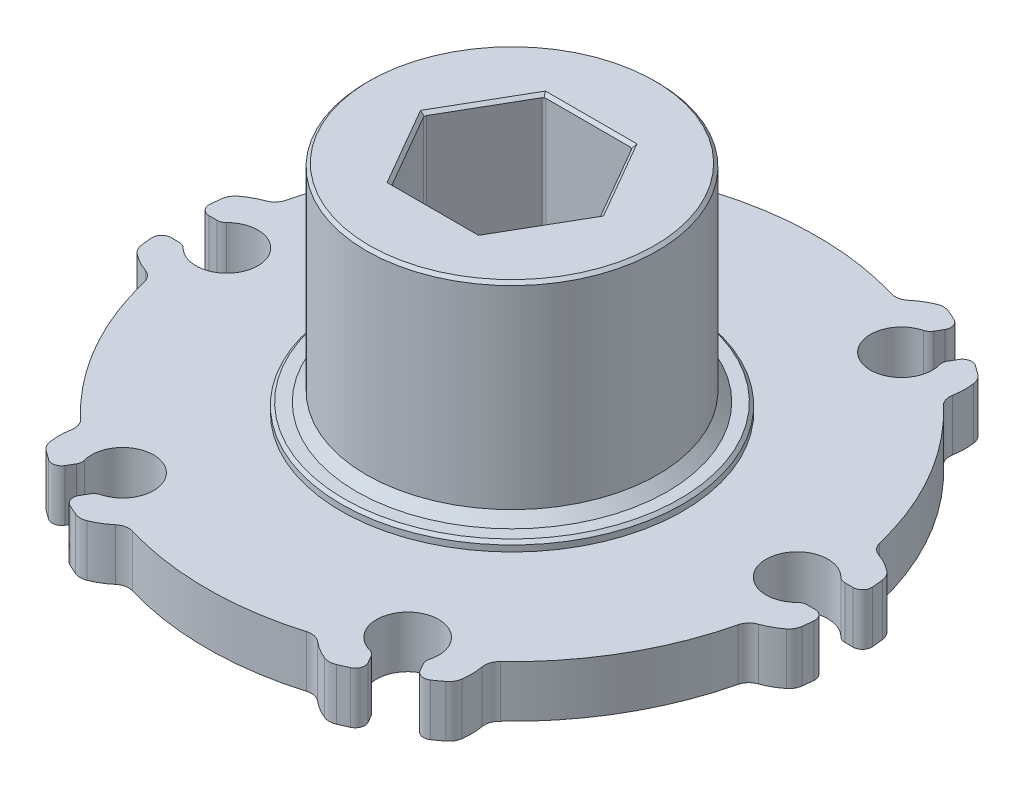
from build123d import *

# Parameters (mm, degrees)
SKETCH1_R                = 27.7876
BOSS_EXTRUDE1_DEPTH      = 8.128
CUT_EXTRUDE1_DEPTH       = 41.129363458
FILLET4_R                = 0.7874
CIRPATTERN1_COUNT        = 6
FILLET4_OF_CIRPATTERN1_R = 0.7874
SKETCH9_R                = 12.1666
BOSS_EXTRUDE2_DEPTH      = 17.272
SKETCH10_R               = 6.4643
CUT_EXTRUDE2_DEPTH       = 47.729610269
SKETCH11_W               = 16.1036
SKETCH11_H               = 3.3147
CUT_EXTRUDE3_DEPTH       = 47.729610269
CHAMFER1_SIZE            = 0.254
FILLET5_R                = 0.127
CHAMFER2_SIZE            = 0.8128
SKETCH12_W               = 23.8252
SKETCH12_H               = 5.08
CHAMFER3_SIZE            = 0.254
SKETCH13_R               = 9.23823544
BOSS_EXTRUDE3_DEPTH      = 25.4
CUT_EXTRUDE4_DEPTH       = 47.729610269
CHAMFER4_SIZE            = 0.254
CUT_EXTRUDE5_DEPTH       = 47.729610269
CIRPATTERN2_COUNT        = 6
FILLET6_R                = 1.27
CHAMFER5_SIZE            = 0.254
FILLET7_R                = 0.254


with BuildPart() as part:
    # Sketch1 → Boss-Extrude1 (new body)
    with BuildSketch(Plane(origin=(0, 0, 0), x_dir=(1, 0, 0), z_dir=(0, 1, 0))):
        with Locations(Location((0, 0, 0), (0, 0, 270))):
            Circle(SKETCH1_R)
    extrude(amount=BOSS_EXTRUDE1_DEPTH)

    # Sketch6 → Cut-Extrude1 (cut, through all)
    with BuildSketch(Plane(origin=(0, 8.128, 0), x_dir=(1, 0, 0), z_dir=(0, 1, 0))):
        with BuildLine():
            Line((25.859959008, 1.5875), (37.457436379, 1.5875))
            Line((37.457436379, 1.5875), (37.457436379, -1.5875))
            Line((37.457436379, -1.5875), (25.859959008, -1.5875))
            ThreePointArc((25.859959008, -1.5875), (21.2217, 0), (25.859959008, 1.5875))
        make_face()
    cut_extrude1 = extrude(amount=-CUT_EXTRUDE1_DEPTH, mode=Mode.SUBTRACT)

    # Fillet4
    fillet4_edges = [part.edges().sort_by_distance(p)[0] for p in [
        (25.859959008, 4.064, -1.5875),
        (27.742216161, 4.064, 1.5875),
        (27.742216161, 4.064, -1.5875),
        (25.859959008, 4.064, 1.5875),
    ]]
    fillet(fillet4_edges, radius=FILLET4_R)

    # CirPattern1: Cut-Extrude1 ×6 about axis
    cirpattern1_axis = Axis((0, 0, 0), (0, 1, 0))
    for i in range(1, CIRPATTERN1_COUNT):
        add(cut_extrude1.rotate(cirpattern1_axis, i * 360 / CIRPATTERN1_COUNT), mode=Mode.SUBTRACT)

    # Fillet4 of CirPattern1
    fillet4_of_cirpattern1_edges = [part.edges().sort_by_distance(p)[0] for p in [
        (11.555164176, 4.064, -23.189131442),
        (15.245923409, 4.064, -23.231713952),
        (12.496292752, 4.064, -24.819213952),
        (14.304794833, 4.064, -21.601631442),
        (-14.304794833, 4.064, -21.601631442),
        (-12.496292752, 4.064, -24.819213952),
        (-15.245923409, 4.064, -23.231713952),
        (-11.555164176, 4.064, -23.189131442),
        (-25.859959008, 4.064, 1.5875),
        (-27.742216161, 4.064, -1.5875),
        (-27.742216161, 4.064, 1.5875),
        (-25.859959008, 4.064, -1.5875),
        (-11.555164176, 4.064, 23.189131442),
        (-15.245923409, 4.064, 23.231713952),
        (-12.496292752, 4.064, 24.819213952),
        (-14.304794833, 4.064, 21.601631442),
        (14.304794833, 4.064, 21.601631442),
        (12.496292752, 4.064, 24.819213952),
        (15.245923409, 4.064, 23.231713952),
        (11.555164176, 4.064, 23.189131442),
    ]]
    fillet(fillet4_of_cirpattern1_edges, radius=FILLET4_OF_CIRPATTERN1_R)

    # Sketch9 → Boss-Extrude2 (add)
    with BuildSketch(Plane(origin=(0, 8.128, 0), x_dir=(-1, 0, 0), z_dir=(0, 1, 0))):
        with Locations(Location((0, 0, 0), (0, 0, 90))):
            Circle(SKETCH9_R)
    extrude(amount=BOSS_EXTRUDE2_DEPTH)

    # Sketch10 → Cut-Extrude2 (cut, through all)
    with BuildSketch(Plane(origin=(0, 25.4, 0), x_dir=(1, 0, 0), z_dir=(0, 1, 0))):
        with Locations(Location((0, 0, 0), (0, 0, 270))):
            Circle(SKETCH10_R)
    extrude(amount=-CUT_EXTRUDE2_DEPTH, mode=Mode.SUBTRACT)

    # Sketch11 → Cut-Extrude3 (cut, through all)
    with BuildSketch(Plane(origin=(0, 25.4, 0), x_dir=(1, 0, 0), z_dir=(0, 1, 0))):
        Rectangle(SKETCH11_W, SKETCH11_H)
    extrude(amount=-CUT_EXTRUDE3_DEPTH, mode=Mode.SUBTRACT)

    # Chamfer1
    chamfer1_edges = [part.edges().sort_by_distance(p)[0] for p in [
        (0, 25.4, -12.1666),
        (0, 0, -6.4643),
        (0, 0, 6.4643),
        (0, 25.4, -6.4643),
        (0, 25.4, 6.4643),
    ]]
    chamfer(chamfer1_edges, length=CHAMFER1_SIZE)

    # Fillet5
    fillet5_edges = [part.edges().sort_by_distance(p)[0] for p in [
        (6.248228986, 12.7, 1.65735),
        (-6.248228986, 12.7, 1.65735),
        (-8.0518, 12.7, 1.65735),
        (-8.0518, 12.7, -1.65735),
        (-6.248228986, 12.7, -1.65735),
        (6.248228986, 12.7, -1.65735),
        (8.0518, 12.7, -1.65735),
        (8.0518, 12.7, 1.65735),
    ]]
    fillet(fillet5_edges, radius=FILLET5_R)

    # Chamfer2
    chamfer2_edges = [part.edges().sort_by_distance(p)[0] for p in [
        (0, 8.128, -12.1666),
    ]]
    chamfer(chamfer2_edges, length=CHAMFER2_SIZE)

    # Sketch12 → Cut-Revolve1 (revolve, cut)
    with BuildSketch(Plane.XY, mode=Mode.PRIVATE) as cut_revolve1_sk:
        with Locations((-26.1874, 9.906)):
            Rectangle(SKETCH12_W, SKETCH12_H)
        Polygon((-38.1, 3.048), (-14.2748, 3.048), (-14.2748, 1.524), (-8.89, 1.524), (-8.89, -2.032), (-14.2875, -2.032), (-38.1, -2.032), align=None)
    revolve(cut_revolve1_sk.sketch.rotate(Axis((0, -1.075785146, 0), (0, 1, 0)), 270), axis=Axis((0, -1.075785146, 0), (0, 1, 0)), mode=Mode.SUBTRACT)

    # Chamfer3
    chamfer3_edges = [part.edges().sort_by_distance(p)[0] for p in [
        (0, 8.128, 14.2748),
        (0, 1.524, 14.2748),
    ]]
    chamfer(chamfer3_edges, length=CHAMFER3_SIZE)

    # Sketch13 → Boss-Extrude3 (add)
    with BuildSketch(Plane(origin=(0, 25.4, 0), x_dir=(1, 0, 0), z_dir=(0, 1, 0))):
        with Locations(Location((0, 0, 0), (0, 0, 270))):
            Circle(SKETCH13_R)
    extrude(amount=-BOSS_EXTRUDE3_DEPTH)

    # Sketch14 → Cut-Extrude4 (cut, through all)
    with BuildSketch(Plane(origin=(0, 25.4, 0), x_dir=(1, 0, 0), z_dir=(0, 1, 0))):
        Polygon((7.347013116, 0), (3.673506558, 6.3627), (-3.673506558, 6.3627), (-7.347013116, 0), (-3.673506558, -6.3627), (3.673506558, -6.3627), align=None)
    extrude(amount=-CUT_EXTRUDE4_DEPTH, mode=Mode.SUBTRACT)

    # Chamfer4
    chamfer4_edges = [part.edges().sort_by_distance(p)[0] for p in [
        (5.510259837, 0, 3.18135),
        (0, 0, 6.3627),
        (-5.510259837, 0, 3.18135),
        (-5.510259837, 0, -3.18135),
        (0, 0, -6.3627),
        (5.510259837, 0, -3.18135),
        (5.510259837, 25.4, 3.18135),
        (5.510259837, 25.4, -3.18135),
        (0, 25.4, -6.3627),
        (-5.510259837, 25.4, -3.18135),
        (-5.510259837, 25.4, 3.18135),
        (0, 25.4, 6.3627),
    ]]
    chamfer(chamfer4_edges, length=CHAMFER4_SIZE)

    # Sketch15 → Cut-Extrude5 (cut, through all)
    with BuildSketch(Plane.XZ):
        with BuildLine():
            ThreePointArc((-17.527955912, 18.505533895), (-22.074034915, 12.74445), (-24.79024042, 5.926888149))
            ThreePointArc((-24.79024042, 5.926888149), (-25.080657079, 5.373490839), (-25.599865957, 5.025622244))
            ThreePointArc((-25.599865957, 5.025622244), (-27.243026047, 4.08448859), (-28.453842, 2.628592863))
            ThreePointArc((-28.453842, 2.628592863), (-24.746675913, 14.2875), (-16.503349196, 23.327453576))
            ThreePointArc((-16.503349196, 23.327453576), (-17.158783904, 21.550908338), (-17.152249511, 19.65732313))
            ThreePointArc((-17.152249511, 19.65732313), (-17.193908113, 19.033740755), (-17.527955912, 18.505533895))
        make_face()
    cut_extrude5 = extrude(amount=-CUT_EXTRUDE5_DEPTH, mode=Mode.SUBTRACT)

    # CirPattern2: Cut-Extrude5 ×6 about axis
    cirpattern2_axis = Axis((0, 0, 0), (0, 1, 0))
    for i in range(1, CIRPATTERN2_COUNT):
        add(cut_extrude5.rotate(cirpattern2_axis, i * 360 / CIRPATTERN2_COUNT), mode=Mode.SUBTRACT)

    # Fillet6
    fillet6_edges = [part.edges().sort_by_distance(p)[0] for p in [
        (-27.521980347, 5.207, 3.832924674),
        (-17.080400312, 5.207, 21.918271806),
        (-17.080400312, 5.207, -21.918271806),
        (-27.521980347, 5.207, -3.832924674),
        (10.441580035, 5.207, -25.75119648),
        (-10.441580035, 5.207, -25.75119648),
        (27.521980347, 5.207, -3.832924674),
        (17.080400312, 5.207, -21.918271806),
        (17.080400312, 5.207, 21.918271806),
        (27.521980347, 5.207, 3.832924674),
        (-10.441580035, 5.207, 25.75119648),
        (10.441580035, 5.207, 25.75119648),
    ]]
    fillet(fillet6_edges, radius=FILLET6_R)

    # Chamfer5
    chamfer5_edges = [part.edges().sort_by_distance(p)[0] for p in [
        (0, 0, -9.23823544),
    ]]
    chamfer(chamfer5_edges, length=CHAMFER5_SIZE)

    # Fillet7
    fillet7_edges = [part.edges().sort_by_distance(p)[0] for p in [
        (3.673506558, 12.7, 6.3627),
        (-3.673506558, 12.7, 6.3627),
        (-7.347013116, 12.7, 0),
        (-3.673506558, 12.7, -6.3627),
        (3.673506558, 12.7, -6.3627),
        (7.347013116, 12.7, 0),
    ]]
    fillet(fillet7_edges, radius=FILLET7_R)


solid = part.part
